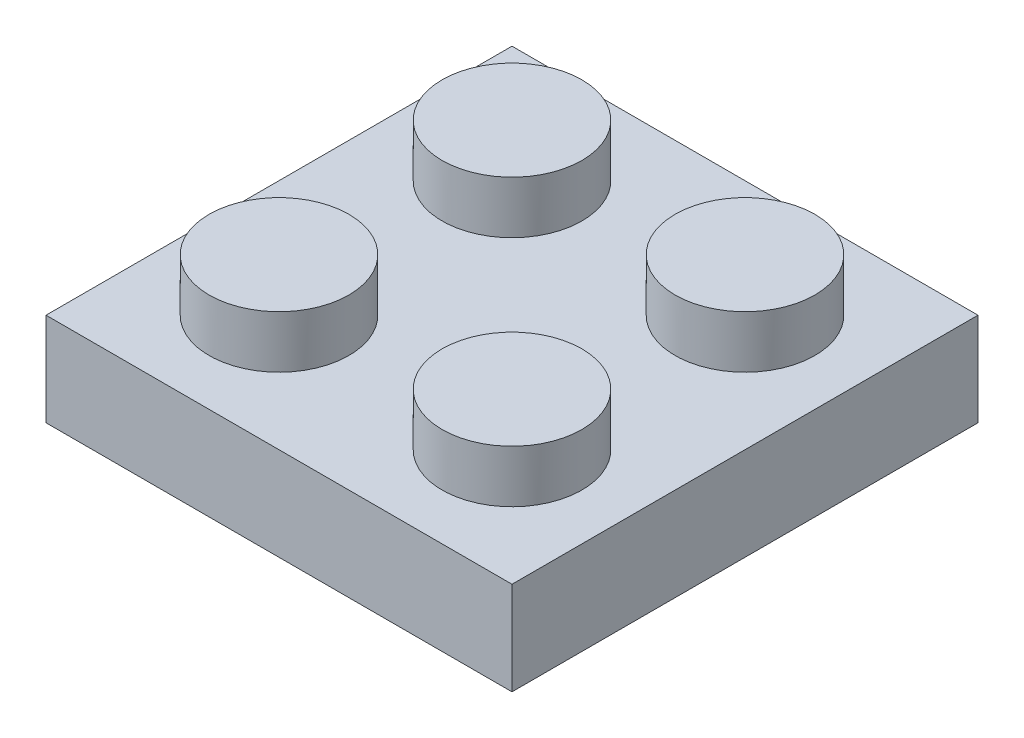
from build123d import *

# Parameters (mm, degrees)
SKETCH1_W           = 16
SKETCH1_H           = 16
BOSS_EXTRUDE1_DEPTH = 3.2
SKETCH2_R           = 2.4
BOSS_EXTRUDE2_DEPTH = 1.8
SKETCH3_W           = 12.8
SKETCH3_H           = 12.8
CUT_EXTRUDE1_DEPTH  = 1.8
SKETCH4_R           = 3.25685425
BOSS_EXTRUDE3_DEPTH = 1.8
SKETCH5_R           = 2.45685425
CUT_EXTRUDE2_DEPTH  = 1.8


with BuildPart() as part:
    # Sketch1 → Boss-Extrude1 (new body)
    with BuildSketch(Plane(origin=(0, 0, 0), x_dir=(1, 0, 0), z_dir=(0, 1, 0))):
        with Locations((8, 8)):
            Rectangle(SKETCH1_W, SKETCH1_H)
    extrude(amount=BOSS_EXTRUDE1_DEPTH)

    # Sketch2 → Boss-Extrude2 (add)
    with BuildSketch(Plane(origin=(0, 3.2, 0), x_dir=(1, 0, 0), z_dir=(0, 1, 0))):
        with Locations((4, 12)):
            Circle(SKETCH2_R)
        with Locations((12, 12)):
            Circle(SKETCH2_R)
        with Locations((12, 4)):
            Circle(SKETCH2_R)
        with Locations((4, 4)):
            Circle(SKETCH2_R)
    extrude(amount=BOSS_EXTRUDE2_DEPTH)

    # Sketch3 → Cut-Extrude1 (cut)
    with BuildSketch(Plane.XZ):
        with Locations((8, -8)):
            Rectangle(SKETCH3_W, SKETCH3_H)
    extrude(amount=-CUT_EXTRUDE1_DEPTH, mode=Mode.SUBTRACT)

    # Sketch4 → Boss-Extrude3 (add)
    with BuildSketch(Plane.XZ.offset(-1.8)):
        with Locations((8, -8)):
            Circle(SKETCH4_R)
    extrude(amount=BOSS_EXTRUDE3_DEPTH)

    # Sketch5 → Cut-Extrude2 (cut)
    with BuildSketch(Plane.XZ):
        with Locations((8, -8)):
            Circle(SKETCH5_R)
    extrude(amount=-CUT_EXTRUDE2_DEPTH, mode=Mode.SUBTRACT)


solid = part.part
